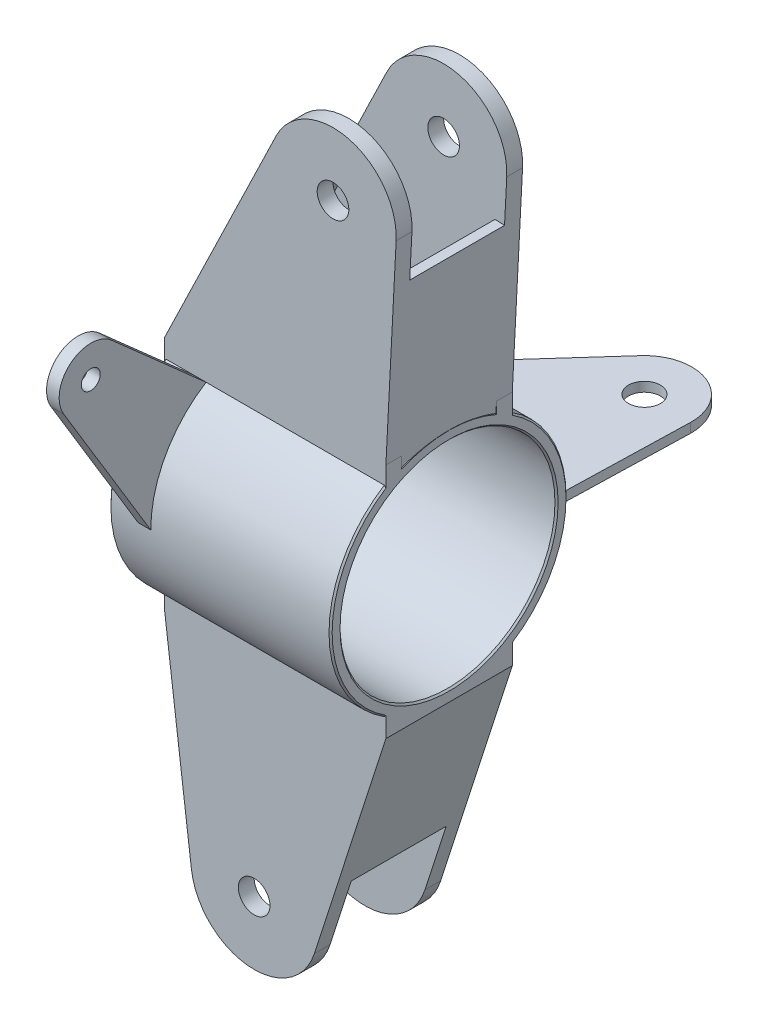
from build123d import *

# Parameters (mm, degrees)
SKETCH1_R             = 37.5
SKETCH1_R_2           = 34.007
BOSS_EXTRUDE1_DEPTH   = 35
BOSS_EXTRUDE2_START   = 15
SKETCH4_R             = 5.007
BOSS_EXTRUDE2_DEPTH   = 5
BOSS_EXTRUDE2_2_DEPTH = 5
BOSS_EXTRUDE3_START   = -15
SKETCH5_R             = 5.007
BOSS_EXTRUDE3_DEPTH   = 5
BOSS_EXTRUDE3_2_DEPTH = 5
BOSS_EXTRUDE4_DEPTH   = 70
CHAMFER1_SIZE         = 0.5
CHAMFER2_SIZE         = 0.5
BOSS_EXTRUDE8_DEPTH   = 3
SKETCH13_W            = 30
SKETCH13_H            = 55
BOSS_EXTRUDE9_DEPTH   = 3
BOSS_EXTRUDE10_DEPTH  = 3
SKETCH15_W            = 30
SKETCH15_H            = 50
BOSS_EXTRUDE11_DEPTH  = 3
BOSS_EXTRUDE12_DEPTH  = 3
SKETCH17_W            = 30
SKETCH17_H            = 52
BOSS_EXTRUDE13_DEPTH  = 3
BOSS_EXTRUDE14_DEPTH  = 3
SKETCH21_R            = 5.05
BOSS_EXTRUDE15_DEPTH  = 1.5
BOSS_EXTRUDE16_START  = 4
SKETCH22_R            = 3
BOSS_EXTRUDE16_DEPTH  = 4


with BuildPart() as part:
    # Sketch1 → Boss-Extrude1 (new, symmetric)
    with BuildSketch(Plane(origin=(0, 0, 0), x_dir=(0, 0, -1), z_dir=(1, 0, 0))):
        Circle(SKETCH1_R)
        Circle(SKETCH1_R_2, mode=Mode.SUBTRACT)
    extrude(amount=BOSS_EXTRUDE1_DEPTH, both=True)



with BuildPart() as body_2:
    # Sketch4 → Boss-Extrude2 (new body)
    with BuildSketch(Plane.XY.offset(BOSS_EXTRUDE2_START)):
        with BuildLine():
            Line((0.275652512, 110.319327951), (-35, 37.5))
            Line((-35, 37.5), (35, 37.5))
            Line((35, 37.5), (38.248437197, 100.571279081))
            ThreePointArc((38.248437197, 100.571279081), (23.247893056, 120.971872737), (0.275652512, 110.319327951))
        make_face()
        with Locations((18.274911388, 101.6)):
            Circle(SKETCH4_R, mode=Mode.SUBTRACT)
    extrude(amount=BOSS_EXTRUDE2_DEPTH)


with BuildPart() as body_3:
    # Sketch4 → Boss-Extrude2 2 (new body)
    with BuildSketch(Plane.XY.offset(BOSS_EXTRUDE2_START)):
        with BuildLine():
            Line((-35, -37.5), (-26.514661672, -104.126718952))
            ThreePointArc((-26.514661672, -104.126718952), (-8.523708177, -121.514365429), (12.360633821, -107.735798124))
            Line((12.360633821, -107.735798124), (35, -37.5))
            Line((35, -37.5), (-35, -37.5))
        make_face()
        with Locations((-6.674911388, -101.6)):
            Circle(SKETCH4_R, mode=Mode.SUBTRACT)
    extrude(amount=BOSS_EXTRUDE2_2_DEPTH)


with BuildPart() as body_4:
    # Sketch5 → Boss-Extrude3 (new body)
    with BuildSketch(Plane.XY.offset(BOSS_EXTRUDE3_START)):
        with BuildLine():
            Line((35, -37.5), (-35, -37.5))
            Line((-35, -37.5), (-26.514661672, -104.126718952))
            ThreePointArc((-26.514661672, -104.126718952), (-8.523708177, -121.514365429), (12.360633821, -107.735798124))
            Line((12.360633821, -107.735798124), (35, -37.5))
        make_face()
        with Locations((-6.674911388, -101.6)):
            Circle(SKETCH5_R, mode=Mode.SUBTRACT)
    extrude(amount=-BOSS_EXTRUDE3_DEPTH)


with BuildPart() as body_5:
    # Sketch5 → Boss-Extrude3 2 (new body)
    with BuildSketch(Plane.XY.offset(BOSS_EXTRUDE3_START)):
        with BuildLine():
            Line((35, 37.5), (38.248437197, 100.571279081))
            ThreePointArc((38.248437197, 100.571279081), (23.247893056, 120.971872737), (0.275652512, 110.319327951))
            Line((0.275652512, 110.319327951), (-35, 37.5))
            Line((-35, 37.5), (35, 37.5))
        make_face()
        with Locations((18.274911388, 101.6)):
            Circle(SKETCH5_R, mode=Mode.SUBTRACT)
    extrude(amount=-BOSS_EXTRUDE3_2_DEPTH)


with BuildPart() as part_1:
    add(part.part)

    add(body_2.part)  # Boss-Extrude4 merges body 2

    add(body_3.part)  # Boss-Extrude4 merges body 3

    add(body_4.part)  # Boss-Extrude4 merges body 4

    add(body_5.part)  # Boss-Extrude4 merges body 5
    # Sketch6 → Boss-Extrude4 (add)
    with BuildSketch(Plane(origin=(35, 0, 0), x_dir=(0, 0, -1), z_dir=(1, 0, 0))):
        with BuildLine():
            Line((20, -37.5), (15, -37.5))
            Line((15, -37.5), (15, -34.369317712))
            ThreePointArc((15, -34.369317712), (17.550008803, -33.139812779), (20, -31.721443851))
            Line((20, -31.721443851), (20, -37.5))
        make_face()
        with BuildLine():
            Line((-20, -37.5), (-15, -37.5))
            Line((-15, -37.5), (-15, -34.369317712))
            ThreePointArc((-15, -34.369317712), (-17.550008803, -33.139812779), (-20, -31.721443851))
            Line((-20, -31.721443851), (-20, -37.5))
        make_face()
        with BuildLine():
            Line((20, 37.5), (15, 37.5))
            Line((15, 37.5), (15, 34.369317712))
            ThreePointArc((15, 34.369317712), (17.550008803, 33.139812779), (20, 31.721443851))
            Line((20, 31.721443851), (20, 37.5))
        make_face()
        with BuildLine():
            Line((-20, 37.5), (-15, 37.5))
            Line((-15, 37.5), (-15, 34.369317712))
            ThreePointArc((-15, 34.369317712), (-17.550008803, 33.139812779), (-20, 31.721443851))
            Line((-20, 31.721443851), (-20, 37.5))
        make_face()
    extrude(amount=-BOSS_EXTRUDE4_DEPTH)

    # Chamfer1
    chamfer1_edges = [part_1.edges().sort_by_distance(p)[0] for p in [
        (35, -37.5, 0),
        (35, 37.5, 0),
        (35, 0, 34.007),
        (35, 0, 37.5),
        (35, 0, -37.5),
    ]]
    chamfer(chamfer1_edges, length=CHAMFER1_SIZE)

    # Chamfer2
    chamfer2_edges = [part_1.edges().sort_by_distance(p)[0] for p in [
        (-35, 0, -37.5),
        (-35, -37.5, 0),
        (-35, 37.5, 0),
        (-35, 0, 34.007),
        (-35, 0, 37.5),
    ]]
    chamfer(chamfer2_edges, length=CHAMFER2_SIZE)

    # Sketch12 → Boss-Extrude8 (add)
    with BuildSketch(Plane(origin=(32.981103177, -1.69866608, 0), x_dir=(0, 0, -1), z_dir=(0.9986762904840372, -0.05143604597014742, 0))):
        with BuildLine():
            Line((-15, 39.250622502), (-15, 88.751284357))
            Line((-15, 88.751284357), (15, 88.751284357))
            Line((15, 88.751284357), (15, 39.250622502))
            Line((15, 39.250622502), (15, 35.578558741))
            add(Edge.make_bspline(
                [(15, 35.578558741), (0, 42.22201753), (-15, 35.578558741)],
                knots=[1.153374055, 1.153374055, 1.153374055, 1.988218598, 1.988218598, 1.988218598], degree=2, weights=[1, 0.914137001, 1]))
            Line((-15, 35.578558741), (-15, 39.250622502))
        make_face()
    extrude(amount=-BOSS_EXTRUDE8_DEPTH)

    # Sketch13 → Boss-Extrude9 (add)
    with BuildSketch(Plane(origin=(-43.060925602, 20.859877331, 0), x_dir=(0, 0, 1), z_dir=(-0.8999629437964011, 0.435966397550678, 0))):
        with Locations((0, 45.989786478)):
            Rectangle(SKETCH13_W, SKETCH13_H)
    extrude(amount=-BOSS_EXTRUDE9_DEPTH)

    # Sketch14 → Boss-Extrude10 (add)
    with BuildSketch(Plane.ZY.offset(35)):
        with BuildLine():
            Line((15, 37.5), (15, 33.823069051))
            ThreePointArc((15, 33.823069051), (0, 37), (-15, 33.823069051))
            Line((-15, 33.823069051), (-15, 37.5))
            Line((-15, 37.5), (15, 37.5))
        make_face()
    extrude(amount=-BOSS_EXTRUDE10_DEPTH)

    # Sketch15 → Boss-Extrude11 (add)
    with BuildSketch(Plane(origin=(-39.141011091, -4.984857829, 0), x_dir=(0, 0, 1), z_dir=(-0.9919875142057744, -0.1263359476152713, 0))):
        with Locations((0, -57.777773616)):
            Rectangle(SKETCH15_W, SKETCH15_H)
    extrude(amount=-BOSS_EXTRUDE11_DEPTH)

    # Sketch16 → Boss-Extrude12 (add)
    with BuildSketch(Plane.ZY.offset(35)):
        with BuildLine():
            Line((15, -37.5), (-15, -37.5))
            Line((-15, -37.5), (-15, -33.823069051))
            ThreePointArc((-15, -33.823069051), (0, -37), (15, -33.823069051))
            Line((15, -33.823069051), (15, -37.5))
        make_face()
    extrude(amount=-BOSS_EXTRUDE12_DEPTH)

    # Sketch17 → Boss-Extrude13 (add)
    with BuildSketch(Plane(origin=(42.655635488, -13.749349722, 0), x_dir=(0, 0, -1), z_dir=(0.9517772604145124, -0.30678990621897206, 0))):
        with Locations((0, -50.954000548)):
            Rectangle(SKETCH17_W, SKETCH17_H)
    extrude(amount=-BOSS_EXTRUDE13_DEPTH)

    # Sketch19 → Boss-Extrude14 (add)
    with BuildSketch(Plane(origin=(35, 0, 0), x_dir=(0, 0, -1), z_dir=(1, 0, 0))):
        with BuildLine():
            Line((-15, -37.5), (-15, -33.823069051))
            ThreePointArc((-15, -33.823069051), (0, -37), (15, -33.823069051))
            Line((15, -33.823069051), (15, -37.5))
            Line((15, -37.5), (-15, -37.5))
        make_face()
    extrude(amount=-BOSS_EXTRUDE14_DEPTH)

    # Sketch22 → Boss-Extrude16 (add)
    with BuildSketch(Plane(origin=(-25.9, 0, 0), x_dir=(0, 0, -1), z_dir=(1, 0, 0)).offset(BOSS_EXTRUDE16_START)):
        with BuildLine():
            Line((-20, 31.721443851), (-49.846569163, 58.152097784))
            ThreePointArc((-49.846569163, 58.152097784), (-62.88120643, 58.345214822), (-65.03129666, 45.487681042))
            Line((-65.03129666, 45.487681042), (-37.5, 0))
            ThreePointArc((-37.5, 0), (-32.834813841, 18.114220933), (-20, 31.721443851))
        make_face()
        with Locations(Location((-56.476235818, 50.665608617, 0), (0, 0, 90))):
            Circle(SKETCH22_R, mode=Mode.SUBTRACT)
    extrude(amount=-BOSS_EXTRUDE16_DEPTH)


with BuildPart() as body_2_2:
    # Sketch21 → Boss-Extrude15 (new, symmetric)
    with BuildSketch(Plane(origin=(0, 0, 0), x_dir=(1, 0, 0), z_dir=(0, 1, 0))):
        with BuildLine():
            Line((34.5, 37.5), (-34.5, 37.5))
            Line((-34.5, 37.5), (9.384212743, 86.306519652))
            ThreePointArc((9.384212743, 86.306519652), (26.096971037, 90.209351988), (35.532926057, 75.873692154))
            Line((35.532926057, 75.873692154), (34.5, 37.5))
        make_face()
        with Locations(Location((20.538357267, 76.277309318, 0), (0, 0, 270))):
            Circle(SKETCH21_R, mode=Mode.SUBTRACT)
    extrude(amount=BOSS_EXTRUDE15_DEPTH, both=True)


solid = Compound([part_1.part, body_2_2.part])
